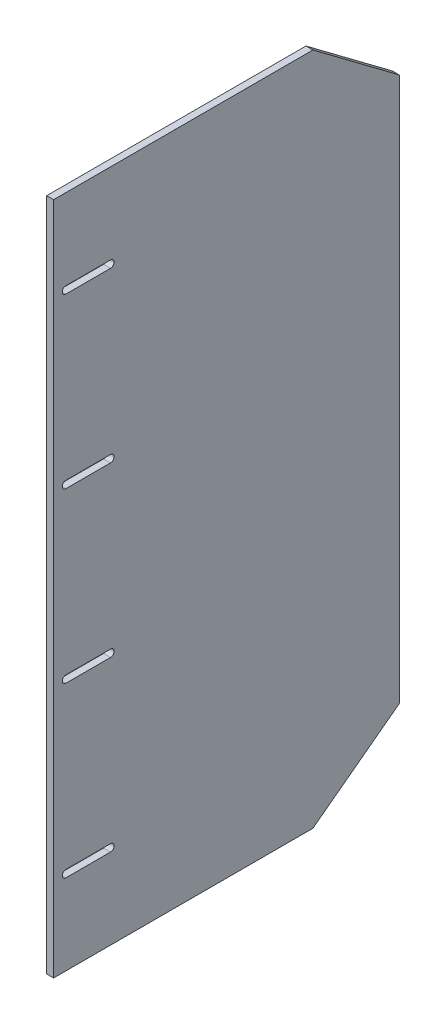
from build123d import *

# Parameters (mm, degrees)
BOSS_EXTRUDE1_DEPTH = 4


with BuildPart() as part:
    # Sketch1 → Boss-Extrude1 (new body)
    with BuildSketch(Plane.YZ):
        Polygon((37.5, -50), (352.5, -50), (390, 0), (390, 150), (0, 150), (0, 0), align=None)
        with BuildLine():
            ThreePointArc((339.15, 117.1), (341.25, 115), (343.35, 117.1))
            Line((343.35, 117.1), (343.35, 142.9))
            ThreePointArc((343.35, 142.9), (341.25, 145), (339.15, 142.9))
            Line((339.15, 142.9), (339.15, 117.1))
        make_face(mode=Mode.SUBTRACT)
        with BuildLine():
            ThreePointArc((144.15, 117.1), (146.25, 115), (148.35, 117.1))
            Line((148.35, 117.1), (148.35, 142.9))
            ThreePointArc((148.35, 142.9), (146.25, 145), (144.15, 142.9))
            Line((144.15, 142.9), (144.15, 117.1))
        make_face(mode=Mode.SUBTRACT)
        with BuildLine():
            Line((50.85, 142.9), (50.85, 117.1))
            ThreePointArc((50.85, 117.1), (48.75, 115), (46.65, 117.1))
            Line((46.65, 117.1), (46.65, 142.9))
            ThreePointArc((46.65, 142.9), (48.75, 145), (50.85, 142.9))
        make_face(mode=Mode.SUBTRACT)
        with BuildLine():
            Line((245.85, 142.9), (245.85, 117.1))
            ThreePointArc((245.85, 117.1), (243.75, 115), (241.65, 117.1))
            Line((241.65, 117.1), (241.65, 142.9))
            ThreePointArc((241.65, 142.9), (243.75, 145), (245.85, 142.9))
        make_face(mode=Mode.SUBTRACT)
    extrude(amount=BOSS_EXTRUDE1_DEPTH)


solid = part.part
